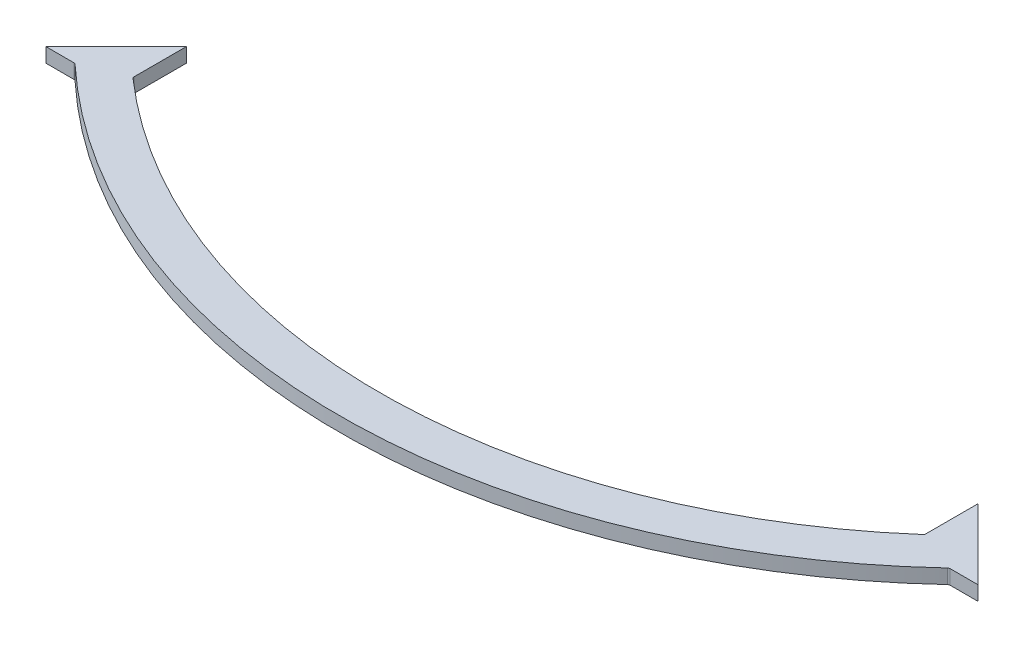
from build123d import *

# Parameters (mm, degrees)
BOSS_EXTRUDE1_DEPTH = 18.25625
SKETCH4_W           = 88.9
SKETCH4_H           = 88.9
BOSS_EXTRUDE2_DEPTH = 18.25625
CUT_EXTRUDE1_DEPTH  = 1003.285006268
FILLET1_R           = 3.3782


with BuildPart() as part:
    # Sketch3 → Boss-Extrude1 (new body)
    with BuildSketch(Plane(origin=(0, 0, 0), x_dir=(1, 0, 0), z_dir=(0, 1, 0))):
        with BuildLine():
            Line((-501.65, -501.65), (-590.55, -590.55))
            Line((-590.55, -590.55), (-553.84414606, -590.55))
            ThreePointArc((-553.84414606, -590.55), (0, -809.625), (553.84414606, -590.55))
            Line((553.84414606, -590.55), (590.55, -590.55))
            Line((590.55, -590.55), (501.65, -501.65))
            Line((501.65, -501.65), (501.65, -569.352841501))
            ThreePointArc((501.65, -569.352841501), (0, -758.825), (-501.65, -569.352841501))
            Line((-501.65, -569.352841501), (-501.65, -501.65))
        make_face()
    extrude(amount=BOSS_EXTRUDE1_DEPTH)

    # Sketch4 → Boss-Extrude2 (add)
    with BuildSketch(Plane(origin=(0, 18.25625, 0), x_dir=(1, 0, 0), z_dir=(0, 1, 0))):
        with Locations((-546.1, -546.1)):
            Rectangle(SKETCH4_W, SKETCH4_H)
        with Locations((546.1, -546.1)):
            Rectangle(SKETCH4_W, SKETCH4_H)
    extrude(amount=-BOSS_EXTRUDE2_DEPTH)

    # Sketch5 → Cut-Extrude1 (cut, through all)
    with BuildSketch(Plane(origin=(0, 18.25625, 0), x_dir=(1, 0, 0), z_dir=(0, 1, 0))):
        Polygon((-590.55, -590.55), (-501.65, -501.65), (-590.55, -501.65), align=None)
        Polygon((501.65, -501.65), (590.55, -590.55), (590.55, -501.65), align=None)
    extrude(amount=-CUT_EXTRUDE1_DEPTH, mode=Mode.SUBTRACT)

    # Fillet1
    fillet1_edges = [part.edges().sort_by_distance(p)[0] for p in [
        (-501.65, 9.128125, 569.352841501),
        (501.65, 9.128125, 569.352841501),
        (553.84414606, 9.128125, 590.55),
        (-553.84414606, 9.128125, 590.55),
    ]]
    fillet(fillet1_edges, radius=FILLET1_R)


solid = part.part
